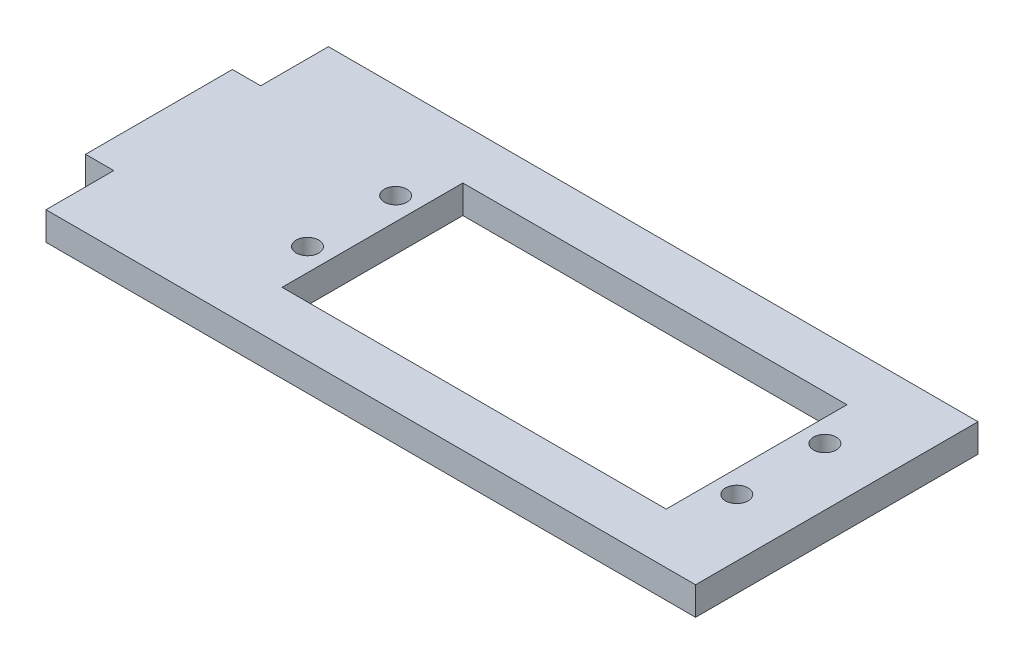
from build123d import *

# Parameters (mm, degrees)
SKETCH1_W           = 76.2
SKETCH1_H           = 31.75
BOSS_EXTRUDE1_DEPTH = 3.175
SKETCH2_R           = 1.27
SKETCH2_W           = 3.175
SKETCH2_H           = 7.62
SKETCH2_W_2         = 43.18
SKETCH2_H_2         = 20.32
CUT_EXTRUDE1_DEPTH  = 3.175


with BuildPart() as part:
    # Sketch1 → Boss-Extrude1 (new body)
    with BuildSketch(Plane(origin=(0, 0, 0), x_dir=(1, 0, 0), z_dir=(0, 1, 0))):
        with Locations((5.405536898, 2.364922393)):
            Rectangle(SKETCH1_W, SKETCH1_H)
    extrude(amount=BOSS_EXTRUDE1_DEPTH)

    # Sketch2 → Cut-Extrude1 (cut)
    with BuildSketch(Plane(origin=(0, 3.175, 0), x_dir=(1, 0, 0), z_dir=(0, 1, 0))):
        with Locations(Location((37.027343522, 7.508422393, 0), (0, 0, 270))):
            Circle(SKETCH2_R)
        with Locations(Location((37.027343522, -2.397577607, 0), (0, 0, 270))):
            Circle(SKETCH2_R)
        with Locations(Location((-11.232656478, 7.508422393, 0), (0, 0, 270))):
            Circle(SKETCH2_R)
        with Locations(Location((-11.232656478, -2.397577607, 0), (0, 0, 270))):
            Circle(SKETCH2_R)
        with Locations((-31.106963102, 14.429922393)):
            Rectangle(SKETCH2_W, SKETCH2_H)
        with Locations((-31.106963102, -9.700077607)):
            Rectangle(SKETCH2_W, SKETCH2_H)
        with Locations((12.897343522, 2.364922393)):
            Rectangle(SKETCH2_W_2, SKETCH2_H_2)
    extrude(amount=-CUT_EXTRUDE1_DEPTH, mode=Mode.SUBTRACT)


solid = part.part
